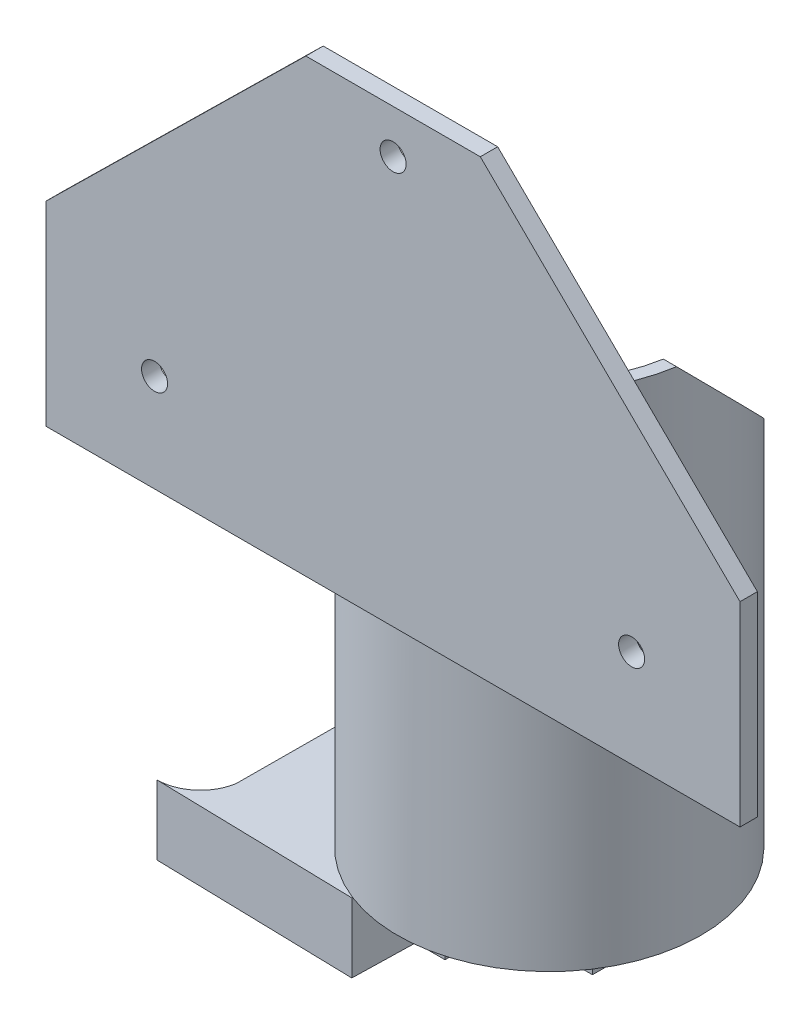
from build123d import *

# Parameters (mm, degrees)
BOSS_EXTRUDE1_DEPTH      = 53
BOSS_EXTRUDE1_DEPTH_BACK = 5
SKETCH1_R                = 17.5
SKETCH2_R                = 16
CUT_EXTRUDE1_DEPTH       = 108
SKETCH3_W                = 25
SKETCH3_H                = 20
CUT_EXTRUDE2_DEPTH       = 108
CUT_EXTRUDE3_DEPTH       = 108
CUT_EXTRUDE3_DEPTH_BACK  = 108
BOSS_EXTRUDE2_DEPTH      = 2
SKETCH10_R               = 1.5
CUT_EXTRUDE4_DEPTH       = 16
BOSS_EXTRUDE3_DEPTH      = 8
BOSS_EXTRUDE5_DEPTH      = 18
BOSS_EXTRUDE5_DEPTH_BACK = 4
SKETCH13_R               = 1.500172947
BOSS_EXTRUDE6_DEPTH      = 8


with BuildPart() as part:
    # Sketch1 → Boss-Extrude1 (new, two sides: drawn at the far end of the back side and taken through both)
    with BuildSketch(Plane(origin=(0, 0, 0), x_dir=(1, 0, 0), z_dir=(0, 1, 0)).offset(-BOSS_EXTRUDE1_DEPTH_BACK)):
        with Locations(Location((0, 0, 0), (0, 0, 270))):
            Circle(SKETCH1_R)
    extrude(amount=BOSS_EXTRUDE1_DEPTH + BOSS_EXTRUDE1_DEPTH_BACK)

    # Sketch2 → Cut-Extrude1 (cut)
    with BuildSketch(Plane(origin=(0, 53, 0), x_dir=(1, 0, 0), z_dir=(0, 1, 0))):
        with Locations(Location((0, 0, 0), (0, 0, 270))):
            Circle(SKETCH2_R)
    extrude(amount=-CUT_EXTRUDE1_DEPTH, mode=Mode.SUBTRACT)

    # Sketch3 → Cut-Extrude2 (cut)
    with BuildSketch(Plane(origin=(0, 53, 0), x_dir=(1, 0, 0), z_dir=(0, 1, 0))):
        with Locations((0, 16)):
            Rectangle(SKETCH3_W, SKETCH3_H)
    extrude(amount=-CUT_EXTRUDE2_DEPTH, mode=Mode.SUBTRACT)

    # Sketch7 → Cut-Extrude3 (cut, two sides: drawn at the far end of the back side and taken through both)
    with BuildSketch(Plane(origin=(0, 0, 0), x_dir=(0, 0, -1), z_dir=(1, 0, 0)).offset(-CUT_EXTRUDE3_DEPTH_BACK)):
        Polygon((12.247448714, 53), (12.247448714, 38), (-2.626275643, 53), align=None)
    extrude(amount=CUT_EXTRUDE3_DEPTH + CUT_EXTRUDE3_DEPTH_BACK, mode=Mode.SUBTRACT)

    # Sketch8 → Boss-Extrude2 (add)
    with BuildSketch(Plane.XY.offset(18)):
        Polygon((10.05709572, 78.023156751), (40, 48.571119754), (40, 26.071119754), (0, 26.071119754), (-40, 26.071119754), (-40, 48.571119754), (-10.05709572, 78.023156751), align=None)
    extrude(amount=-BOSS_EXTRUDE2_DEPTH)

    # Sketch10 → Cut-Extrude4 (cut)
    with BuildSketch(Plane(origin=(0, 0, 16), x_dir=(-1, 0, 0), z_dir=(0, 0, -1))):
        with Locations((-27.5, 37.321119754)):
            Circle(SKETCH10_R)
        with Locations((27.5, 37.321119754)):
            Circle(SKETCH10_R)
        with Locations((0, 73)):
            Circle(SKETCH10_R)
    extrude(amount=-CUT_EXTRUDE4_DEPTH, mode=Mode.SUBTRACT)

    # Sketch11 → Boss-Extrude3 (add)
    with BuildSketch(Plane.XZ.offset(5)):
        with BuildLine():
            Line((-6.390882144, -8.863379027), (-6.480237612, -11.760990645))
            ThreePointArc((-6.480237612, -11.760990645), (-7.33967567, -12.860163004), (-8.724622378, -13.029680754))
            ThreePointArc((-8.724622378, -13.029680754), (-13.107641391, -18.70255332), (-9.931897769, -25.129604841))
            ThreePointArc((-9.931897769, -25.129604841), (-9.756819698, -26.038761874), (-10.275891909, -26.805431868))
            Line((-10.275891909, -26.805431868), (-18.890882144, -26.863380934))
            Line((-18.890882144, -26.863380934), (-18.890882144, -23.863377119))
            Line((-18.890882144, -23.863377119), (-28.890882144, -23.863377119))
            Line((-28.890882144, -23.863377119), (-28.890882144, -16.863377119))
            Line((-28.890882144, -16.863377119), (-31.890882144, -16.863377119))
            ThreePointArc((-31.890882144, -16.863377119), (-29.928759086, -7.76088478), (-24.390882144, -0.275084044))
            Line((-24.390882144, -0.275084044), (-24.452405581, 11.618795847))
            ThreePointArc((-24.452405581, 11.618795847), (-26.143620347, 14.638664645), (-29.390882144, 15.836623644))
            Line((-29.390882144, 15.836623644), (-6.375618396, 16.386397999))
            Line((-6.375618396, 16.386397999), (-6.012446141, 1.182878311))
            Line((-6.012446141, 1.182878311), (-6.390882144, -8.863379027))
        make_face()
    extrude(amount=BOSS_EXTRUDE3_DEPTH)


with BuildPart() as body_2:
    # Sketch12 → Boss-Extrude5 (new, two sides: drawn at the far end of the back side and taken through both)
    with BuildSketch(Plane.XZ.offset(13).offset(-BOSS_EXTRUDE5_DEPTH_BACK)):
        Polygon((-31.890882144, -26.863380934), (-18.890882144, -26.863380934), (-18.890882144, -23.863377119), (-28.890882144, -23.863377119), (-28.890882144, -16.863377119), (-31.890882144, -16.863377119), align=None)
    extrude(amount=BOSS_EXTRUDE5_DEPTH + BOSS_EXTRUDE5_DEPTH_BACK)

    # Sketch13 → Boss-Extrude6 (add)
    with BuildSketch(Plane.XZ.offset(31)):
        Polygon((-44.322698898, -26.807587047), (-18.822698898, -26.807587047), (-18.822698898, -23.807583233), (-28.822698898, -23.807583233), (-28.822698898, -16.807583233), (-44.322698898, -16.807583233), align=None)
        with Locations(Location((-39.936045011, -19.607691517, 0), (0, 0, 90))):
            Circle(SKETCH13_R, mode=Mode.SUBTRACT)
    extrude(amount=BOSS_EXTRUDE6_DEPTH)


solid = Compound([part.part, body_2.part])
